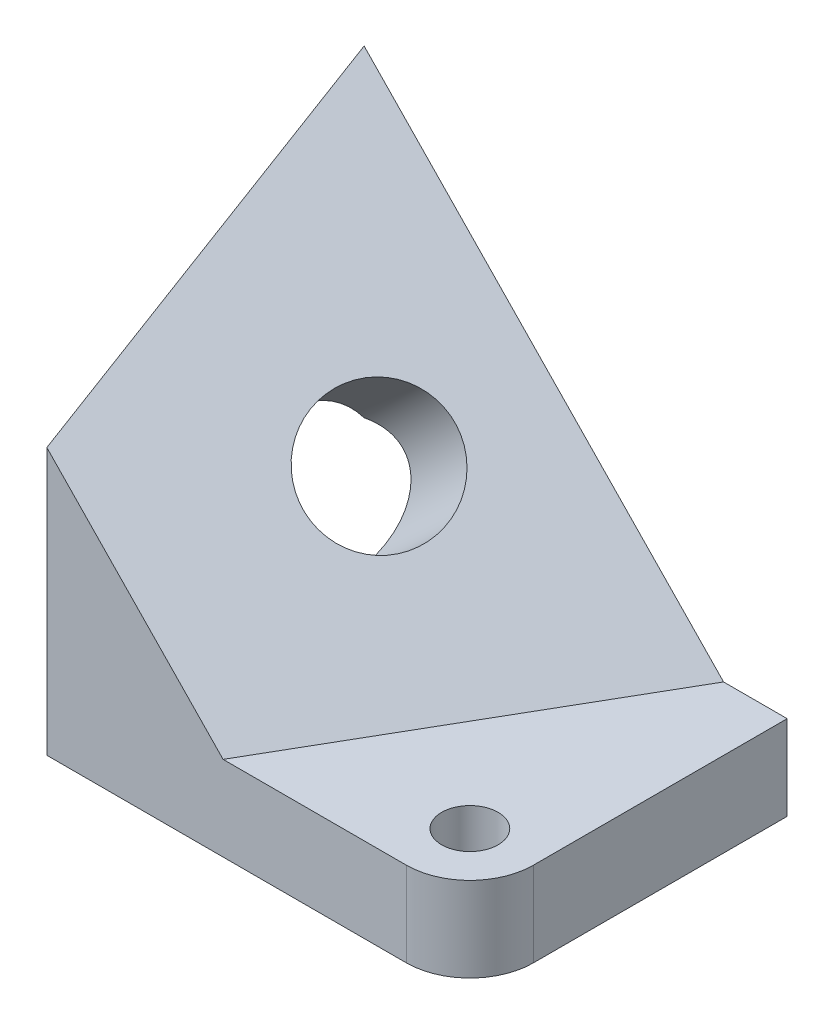
from build123d import *

# Parameters (mm, degrees)
SKETCH_1_R          = 4
EXTRUDE_1_DEPTH     = 12
EXTRUDE_2_DEPTH     = 55
CUT_EXTRUDE_1_DEPTH = 50
SKETCH_9_R          = 9
CUT_EXTRUDE_2_DEPTH = 74.567594408


with BuildPart() as part:
    # 草图1 → 凸台-拉伸1 (new body)
    with BuildSketch(Plane(origin=(0, 0, 0), x_dir=(1, 0, 0), z_dir=(0, 1, 0))):
        with BuildLine():
            Line((-30, 22.5), (30, 22.5))
            Line((30, 22.5), (30, -13.5))
            ThreePointArc((30, -13.5), (27.363961031, -19.863961031), (21, -22.5))
            Line((21, -22.5), (-30, -22.5))
            Line((-30, -22.5), (-30, 22.5))
        make_face()
        with Locations(Location((21, -13.5, 0), (0, 0, 270))):
            Circle(SKETCH_1_R, mode=Mode.SUBTRACT)
    extrude(amount=EXTRUDE_1_DEPTH)

    # 草图5 → 凸台-拉伸2 (add)
    with BuildSketch(Plane(origin=(0, 12, 0), x_dir=(1, 0, 0), z_dir=(0, 1, 0))):
        Polygon((-5, -22.5), (20.980762114, 22.5), (-30, 22.5), (-30, -22.5), align=None)
    extrude(amount=EXTRUDE_2_DEPTH)

    # 草图6 → 切除-拉伸1 (cut)
    with BuildSketch(Plane(origin=(8.633922254, 8.365483215, 4.984797338), x_dir=(0.4999999999999977, 0, -0.86602540378444), z_dir=(-0.6634139481689368, -0.642787609686543, -0.3830222215594858))):
        Polygon((-21.985571585, -4.744524705), (29.975952642, -4.744524705), (46.861281787, -7.759213518), (18.600754365, -97.120116912), (-55.184549729, -73.785397471), align=None)
    extrude(amount=-CUT_EXTRUDE_1_DEPTH, mode=Mode.SUBTRACT)

    # 草图9 → 切除-拉伸2 (cut, through all)
    with BuildSketch(Plane(origin=(8.633922254, 8.365483215, 4.984797338), x_dir=(0.27508013503084955, 0.2665275624016649, -0.9237391286459811), z_dir=(0.663413948168937, 0.6427876096865428, 0.38302222155948573))):
        with Locations(Location((9.830913468, 29.914425108, 0), (0, 0, 90))):
            Circle(SKETCH_9_R)
    extrude(amount=-CUT_EXTRUDE_2_DEPTH, mode=Mode.SUBTRACT)


solid = part.part
